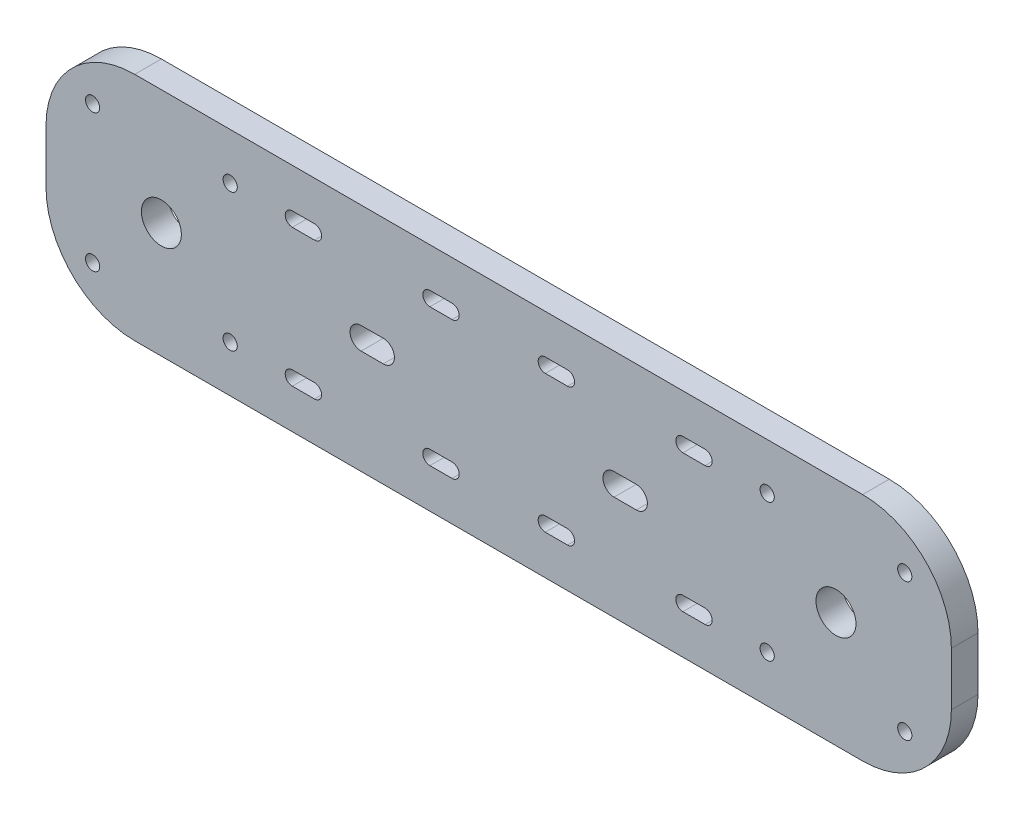
from build123d import *

# Parameters (mm, degrees)
SKETCH_1_W          = 204
SKETCH_1_H          = 52
EXTRUDE_1_DEPTH     = 6
CUT_EXTRUDE_1_REACH = 107.432
SKETCH_2_R          = 1.6
SKETCH_2_R_2        = 4.5
FILLET_3_R          = 20


with BuildPart() as part:
    # 草图1 → 凸台-拉伸1 (new body)
    with BuildSketch(Plane.XY):
        Rectangle(SKETCH_1_W, SKETCH_1_H)
    extrude(amount=EXTRUDE_1_DEPTH)

    # 草图2 → 切除-拉伸1 (cut, up to next)
    with BuildSketch(Plane.XY.offset(6), mode=Mode.PRIVATE) as cut_extrude_1_sk1:
        with Locations((-91.5, 15.5)):
            Circle(SKETCH_2_R)
    cut_extrude_1_tool1 = extrude(cut_extrude_1_sk1.sketch, amount=-CUT_EXTRUDE_1_REACH, mode=Mode.PRIVATE) & part.part
    # 草图2 → 切除-拉伸1 (cut, up to next)
    with BuildSketch(Plane.XY.offset(6), mode=Mode.PRIVATE) as cut_extrude_1_sk2:
        with Locations((-60.5, 15.5)):
            Circle(SKETCH_2_R)
    cut_extrude_1_tool2 = extrude(cut_extrude_1_sk2.sketch, amount=-CUT_EXTRUDE_1_REACH, mode=Mode.PRIVATE) & part.part
    # 草图2 → 切除-拉伸1 (cut, up to next)
    with BuildSketch(Plane.XY.offset(6), mode=Mode.PRIVATE) as cut_extrude_1_sk3:
        with Locations((-91.5, -15.5)):
            Circle(SKETCH_2_R)
    cut_extrude_1_tool3 = extrude(cut_extrude_1_sk3.sketch, amount=-CUT_EXTRUDE_1_REACH, mode=Mode.PRIVATE) & part.part
    # 草图2 → 切除-拉伸1 (cut, up to next)
    with BuildSketch(Plane.XY.offset(6), mode=Mode.PRIVATE) as cut_extrude_1_sk4:
        with Locations((-60.5, -15.5)):
            Circle(SKETCH_2_R)
    cut_extrude_1_tool4 = extrude(cut_extrude_1_sk4.sketch, amount=-CUT_EXTRUDE_1_REACH, mode=Mode.PRIVATE) & part.part
    # 草图2 → 切除-拉伸1 (cut, up to next)
    with BuildSketch(Plane.XY.offset(6), mode=Mode.PRIVATE) as cut_extrude_1_sk5:
        with Locations((60.5, 15.5)):
            Circle(SKETCH_2_R)
    cut_extrude_1_tool5 = extrude(cut_extrude_1_sk5.sketch, amount=-CUT_EXTRUDE_1_REACH, mode=Mode.PRIVATE) & part.part
    # 草图2 → 切除-拉伸1 (cut, up to next)
    with BuildSketch(Plane.XY.offset(6), mode=Mode.PRIVATE) as cut_extrude_1_sk6:
        with Locations((91.5, 15.5)):
            Circle(SKETCH_2_R)
    cut_extrude_1_tool6 = extrude(cut_extrude_1_sk6.sketch, amount=-CUT_EXTRUDE_1_REACH, mode=Mode.PRIVATE) & part.part
    # 草图2 → 切除-拉伸1 (cut, up to next)
    with BuildSketch(Plane.XY.offset(6), mode=Mode.PRIVATE) as cut_extrude_1_sk7:
        with Locations((91.5, -15.5)):
            Circle(SKETCH_2_R)
    cut_extrude_1_tool7 = extrude(cut_extrude_1_sk7.sketch, amount=-CUT_EXTRUDE_1_REACH, mode=Mode.PRIVATE) & part.part
    # 草图2 → 切除-拉伸1 (cut, up to next)
    with BuildSketch(Plane.XY.offset(6), mode=Mode.PRIVATE) as cut_extrude_1_sk8:
        with Locations((60.5, -15.5)):
            Circle(SKETCH_2_R)
    cut_extrude_1_tool8 = extrude(cut_extrude_1_sk8.sketch, amount=-CUT_EXTRUDE_1_REACH, mode=Mode.PRIVATE) & part.part
    # 草图2 → 切除-拉伸1 (cut, up to next)
    with BuildSketch(Plane.XY.offset(6), mode=Mode.PRIVATE) as cut_extrude_1_sk9:
        with Locations((-76, 0)):
            Circle(SKETCH_2_R_2)
    cut_extrude_1_tool9 = extrude(cut_extrude_1_sk9.sketch, amount=-CUT_EXTRUDE_1_REACH, mode=Mode.PRIVATE) & part.part
    # 草图2 → 切除-拉伸1 (cut, up to next)
    with BuildSketch(Plane.XY.offset(6), mode=Mode.PRIVATE) as cut_extrude_1_sk10:
        with Locations((76, 0)):
            Circle(SKETCH_2_R_2)
    cut_extrude_1_tool10 = extrude(cut_extrude_1_sk10.sketch, amount=-CUT_EXTRUDE_1_REACH, mode=Mode.PRIVATE) & part.part
    # 草图2 → 切除-拉伸1 (cut, up to next)
    with BuildSketch(Plane.XY.offset(6), mode=Mode.PRIVATE) as cut_extrude_1_sk11:
        with BuildLine():
            Line((-46.5, 17.1), (-41.5, 17.1))
            ThreePointArc((-41.5, 17.1), (-39.9, 15.5), (-41.5, 13.9))
            Line((-41.5, 13.9), (-46.5, 13.9))
            ThreePointArc((-46.5, 13.9), (-48.1, 15.5), (-46.5, 17.1))
        make_face()
    cut_extrude_1_tool11 = extrude(cut_extrude_1_sk11.sketch, amount=-CUT_EXTRUDE_1_REACH, mode=Mode.PRIVATE) & part.part
    # 草图2 → 切除-拉伸1 (cut, up to next)
    with BuildSketch(Plane.XY.offset(6), mode=Mode.PRIVATE) as cut_extrude_1_sk12:
        with BuildLine():
            Line((-15.5, 17.1), (-10.5, 17.1))
            ThreePointArc((-10.5, 17.1), (-8.9, 15.5), (-10.5, 13.9))
            Line((-10.5, 13.9), (-15.5, 13.9))
            ThreePointArc((-15.5, 13.9), (-17.1, 15.5), (-15.5, 17.1))
        make_face()
    cut_extrude_1_tool12 = extrude(cut_extrude_1_sk12.sketch, amount=-CUT_EXTRUDE_1_REACH, mode=Mode.PRIVATE) & part.part
    # 草图2 → 切除-拉伸1 (cut, up to next)
    with BuildSketch(Plane.XY.offset(6), mode=Mode.PRIVATE) as cut_extrude_1_sk13:
        with BuildLine():
            Line((-46.5, -13.9), (-41.5, -13.9))
            ThreePointArc((-41.5, -13.9), (-39.9, -15.5), (-41.5, -17.1))
            Line((-41.5, -17.1), (-46.5, -17.1))
            ThreePointArc((-46.5, -17.1), (-48.1, -15.5), (-46.5, -13.9))
        make_face()
    cut_extrude_1_tool13 = extrude(cut_extrude_1_sk13.sketch, amount=-CUT_EXTRUDE_1_REACH, mode=Mode.PRIVATE) & part.part
    # 草图2 → 切除-拉伸1 (cut, up to next)
    with BuildSketch(Plane.XY.offset(6), mode=Mode.PRIVATE) as cut_extrude_1_sk14:
        with BuildLine():
            Line((-15.5, -13.9), (-10.5, -13.9))
            ThreePointArc((-10.5, -13.9), (-8.9, -15.5), (-10.5, -17.1))
            Line((-10.5, -17.1), (-15.5, -17.1))
            ThreePointArc((-15.5, -17.1), (-17.1, -15.5), (-15.5, -13.9))
        make_face()
    cut_extrude_1_tool14 = extrude(cut_extrude_1_sk14.sketch, amount=-CUT_EXTRUDE_1_REACH, mode=Mode.PRIVATE) & part.part
    # 草图2 → 切除-拉伸1 (cut, up to next)
    with BuildSketch(Plane.XY.offset(6), mode=Mode.PRIVATE) as cut_extrude_1_sk15:
        with BuildLine():
            Line((10.5, 17.1), (15.5, 17.1))
            ThreePointArc((15.5, 17.1), (17.1, 15.5), (15.5, 13.9))
            Line((15.5, 13.9), (10.5, 13.9))
            ThreePointArc((10.5, 13.9), (8.9, 15.5), (10.5, 17.1))
        make_face()
    cut_extrude_1_tool15 = extrude(cut_extrude_1_sk15.sketch, amount=-CUT_EXTRUDE_1_REACH, mode=Mode.PRIVATE) & part.part
    # 草图2 → 切除-拉伸1 (cut, up to next)
    with BuildSketch(Plane.XY.offset(6), mode=Mode.PRIVATE) as cut_extrude_1_sk16:
        with BuildLine():
            Line((41.5, 17.1), (46.5, 17.1))
            ThreePointArc((46.5, 17.1), (48.1, 15.5), (46.5, 13.9))
            Line((46.5, 13.9), (41.5, 13.9))
            ThreePointArc((41.5, 13.9), (39.9, 15.5), (41.5, 17.1))
        make_face()
    cut_extrude_1_tool16 = extrude(cut_extrude_1_sk16.sketch, amount=-CUT_EXTRUDE_1_REACH, mode=Mode.PRIVATE) & part.part
    # 草图2 → 切除-拉伸1 (cut, up to next)
    with BuildSketch(Plane.XY.offset(6), mode=Mode.PRIVATE) as cut_extrude_1_sk17:
        with BuildLine():
            Line((10.5, -13.9), (15.5, -13.9))
            ThreePointArc((15.5, -13.9), (17.1, -15.5), (15.5, -17.1))
            Line((15.5, -17.1), (10.5, -17.1))
            ThreePointArc((10.5, -17.1), (8.9, -15.5), (10.5, -13.9))
        make_face()
    cut_extrude_1_tool17 = extrude(cut_extrude_1_sk17.sketch, amount=-CUT_EXTRUDE_1_REACH, mode=Mode.PRIVATE) & part.part
    # 草图2 → 切除-拉伸1 (cut, up to next)
    with BuildSketch(Plane.XY.offset(6), mode=Mode.PRIVATE) as cut_extrude_1_sk18:
        with BuildLine():
            Line((41.5, -13.9), (46.5, -13.9))
            ThreePointArc((46.5, -13.9), (48.1, -15.5), (46.5, -17.1))
            Line((46.5, -17.1), (41.5, -17.1))
            ThreePointArc((41.5, -17.1), (39.9, -15.5), (41.5, -13.9))
        make_face()
    cut_extrude_1_tool18 = extrude(cut_extrude_1_sk18.sketch, amount=-CUT_EXTRUDE_1_REACH, mode=Mode.PRIVATE) & part.part
    # 草图2 → 切除-拉伸1 (cut, up to next)
    with BuildSketch(Plane.XY.offset(6), mode=Mode.PRIVATE) as cut_extrude_1_sk19:
        with BuildLine():
            Line((-31, 2.5), (-26, 2.5))
            ThreePointArc((-26, 2.5), (-23.5, 0), (-26, -2.5))
            Line((-26, -2.5), (-31, -2.5))
            ThreePointArc((-31, -2.5), (-33.5, 0), (-31, 2.5))
        make_face()
    cut_extrude_1_tool19 = extrude(cut_extrude_1_sk19.sketch, amount=-CUT_EXTRUDE_1_REACH, mode=Mode.PRIVATE) & part.part
    # 草图2 → 切除-拉伸1 (cut, up to next)
    with BuildSketch(Plane.XY.offset(6), mode=Mode.PRIVATE) as cut_extrude_1_sk20:
        with BuildLine():
            Line((26, 2.5), (31, 2.5))
            ThreePointArc((31, 2.5), (33.5, 0), (31, -2.5))
            Line((31, -2.5), (26, -2.5))
            ThreePointArc((26, -2.5), (23.5, 0), (26, 2.5))
        make_face()
    cut_extrude_1_tool20 = extrude(cut_extrude_1_sk20.sketch, amount=-CUT_EXTRUDE_1_REACH, mode=Mode.PRIVATE) & part.part
    add(cut_extrude_1_tool1.solids().sort_by_distance((-91.5, 15.5, 6))[0], mode=Mode.SUBTRACT)
    add(cut_extrude_1_tool2.solids().sort_by_distance((-60.5, 15.5, 6))[0], mode=Mode.SUBTRACT)
    add(cut_extrude_1_tool3.solids().sort_by_distance((-91.5, -15.5, 6))[0], mode=Mode.SUBTRACT)
    add(cut_extrude_1_tool4.solids().sort_by_distance((-60.5, -15.5, 6))[0], mode=Mode.SUBTRACT)
    add(cut_extrude_1_tool5.solids().sort_by_distance((60.5, 15.5, 6))[0], mode=Mode.SUBTRACT)
    add(cut_extrude_1_tool6.solids().sort_by_distance((91.5, 15.5, 6))[0], mode=Mode.SUBTRACT)
    add(cut_extrude_1_tool7.solids().sort_by_distance((91.5, -15.5, 6))[0], mode=Mode.SUBTRACT)
    add(cut_extrude_1_tool8.solids().sort_by_distance((60.5, -15.5, 6))[0], mode=Mode.SUBTRACT)
    add(cut_extrude_1_tool9.solids().sort_by_distance((-76, 0, 6))[0], mode=Mode.SUBTRACT)
    add(cut_extrude_1_tool10.solids().sort_by_distance((76, 0, 6))[0], mode=Mode.SUBTRACT)
    add(cut_extrude_1_tool11.solids().sort_by_distance((-44, 15.5, 6))[0], mode=Mode.SUBTRACT)
    add(cut_extrude_1_tool12.solids().sort_by_distance((-13, 15.5, 6))[0], mode=Mode.SUBTRACT)
    add(cut_extrude_1_tool13.solids().sort_by_distance((-44, -15.5, 6))[0], mode=Mode.SUBTRACT)
    add(cut_extrude_1_tool14.solids().sort_by_distance((-13, -15.5, 6))[0], mode=Mode.SUBTRACT)
    add(cut_extrude_1_tool15.solids().sort_by_distance((13, 15.5, 6))[0], mode=Mode.SUBTRACT)
    add(cut_extrude_1_tool16.solids().sort_by_distance((44, 15.5, 6))[0], mode=Mode.SUBTRACT)
    add(cut_extrude_1_tool17.solids().sort_by_distance((13, -15.5, 6))[0], mode=Mode.SUBTRACT)
    add(cut_extrude_1_tool18.solids().sort_by_distance((44, -15.5, 6))[0], mode=Mode.SUBTRACT)
    add(cut_extrude_1_tool19.solids().sort_by_distance((-28.5, 0, 6))[0], mode=Mode.SUBTRACT)
    add(cut_extrude_1_tool20.solids().sort_by_distance((28.5, 0, 6))[0], mode=Mode.SUBTRACT)

    # 圆角3
    fillet_3_edges = [part.edges().sort_by_distance(p)[0] for p in [
        (-102, 26, 3),
        (102, 26, 3),
        (102, -26, 3),
        (-102, -26, 3),
    ]]
    fillet(fillet_3_edges, radius=FILLET_3_R)


solid = part.part
